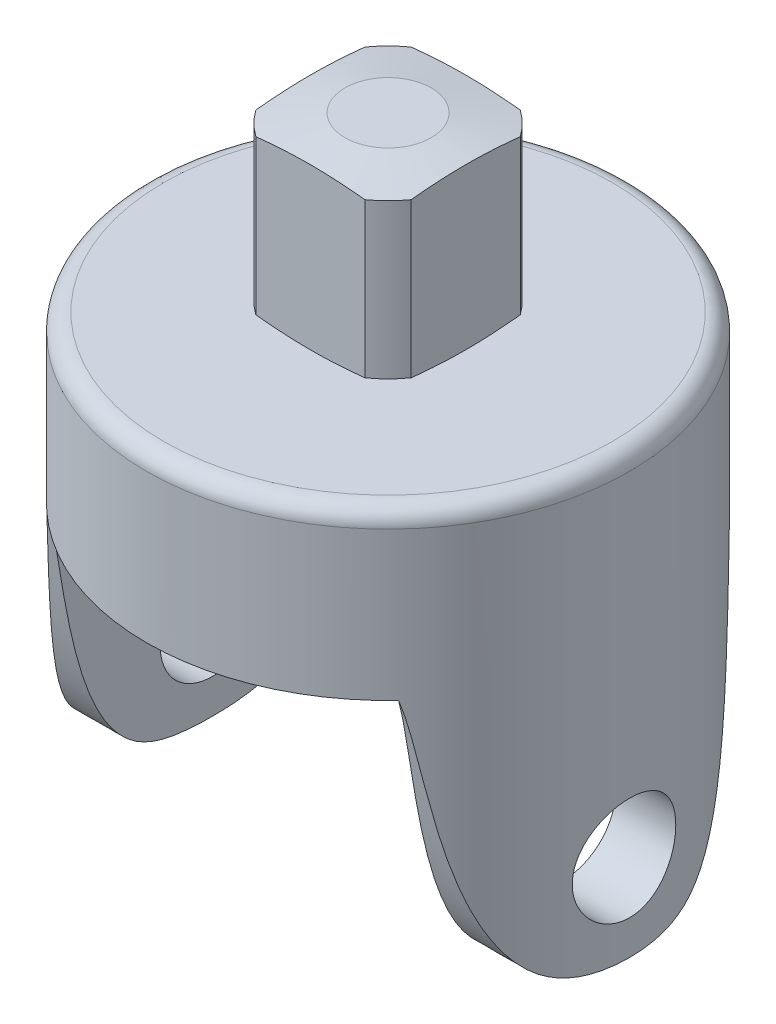
from build123d import *

# Parameters (mm, degrees)
BOSS_EXTRUDE1_DEPTH      = 102
BOSS_EXTRUDE1_DEPTH_BACK = 30
SKETCH1_R                = 70
SKETCH2_W                = 45
SKETCH2_H                = 45
BOSS_EXTRUDE2_DEPTH      = 50
FILLET1_R                = 5
FILLET2_R                = 5
SKETCH4_W                = 102
SKETCH4_H                = 150
CUT_EXTRUDE1_DEPTH       = 84
CUT_EXTRUDE3_DEPTH       = 72
CUT_EXTRUDE4_DEPTH       = 182.394597571
CUT_EXTRUDE4_DEPTH_BACK  = 182.394597571
SKETCH6_R                = 15


with BuildPart() as part:
    # Sketch1 → Boss-Extrude1 (new, two sides: drawn at the far end of the back side and taken through both)
    with BuildSketch(Plane(origin=(0, 0, 0), x_dir=(1, 0, 0), z_dir=(0, 1, 0)).offset(-BOSS_EXTRUDE1_DEPTH_BACK)):
        with Locations(Location((0, 0, 0), (0, 0, 270))):
            Circle(SKETCH1_R)
    extrude(amount=BOSS_EXTRUDE1_DEPTH + BOSS_EXTRUDE1_DEPTH_BACK)

    # Sketch2 → Boss-Extrude2 (add)
    with BuildSketch(Plane(origin=(0, 102, 0), x_dir=(1, 0, 0), z_dir=(0, 1, 0))):
        Rectangle(SKETCH2_W, SKETCH2_H)
    extrude(amount=BOSS_EXTRUDE2_DEPTH)

    # Fillet1
    fillet1_edges = [part.edges().sort_by_distance(p)[0] for p in [
        (0, 102, -70),
    ]]
    fillet(fillet1_edges, radius=FILLET1_R)

    # Fillet2
    fillet2_edges = [part.edges().sort_by_distance(p)[0] for p in [
        (0, -30, -70),
    ]]
    fillet(fillet2_edges, radius=FILLET2_R)

    # Sketch3 → Cut-Revolve2 (revolve, cut)
    with BuildSketch(Plane.XY, mode=Mode.PRIVATE) as cut_revolve2_sk:
        Polygon((-12.5, 152), (-47.512769581, 152), (-47.512769581, 102), (-12.5, 102), (-27.5, 104.644904711), (-27.5, 149.355095289), align=None)
    revolve(cut_revolve2_sk.sketch.rotate(Axis((0, 160.85, 0), (0, -1, 0)), 270), axis=Axis((0, 160.85, 0), (0, -1, 0)), mode=Mode.SUBTRACT)

    # Sketch4 → Cut-Extrude1 (cut)
    with BuildSketch(Plane.XZ.offset(30)):
        Rectangle(SKETCH4_W, SKETCH4_H)
    extrude(amount=-CUT_EXTRUDE1_DEPTH, mode=Mode.SUBTRACT)

    # Sketch5 → Cut-Extrude3 (cut, symmetric)
    with BuildSketch(Plane(origin=(0, 0, 0), x_dir=(0, 0, -1), z_dir=(1, 0, 0))):
        with BuildLine():
            Line((-47.947888379, 54), (-70, 54))
            Line((-70, 54), (-70, -34.210439424))
            Line((-70, -34.210439424), (78.024892387, -34.210439424))
            Line((78.024892387, -34.210439424), (78.024892387, 54))
            Line((78.024892387, 54), (47.947888379, 54))
            add(Edge.make_bspline(
                [(47.947888379, 54), (43.174062714, 36.113920215), (41.307491939, -20.223592095), (8.979551546, -25), (0, -25)],
                knots=[0, 0, 0, 0, 0.785107117, 1, 1, 1, 1], degree=3))
            add(Edge.make_bspline(
                [(-47.947888379, 54), (-43.174062714, 36.113920215), (-41.307491939, -20.223592095), (-8.979551546, -25), (0, -25)],
                knots=[0, 0, 0, 0, 0.785107117, 1, 1, 1, 1], degree=3))
        make_face()
    extrude(amount=CUT_EXTRUDE3_DEPTH, both=True, mode=Mode.SUBTRACT)

    # Sketch6 → Cut-Extrude4 (cut, two sides: drawn at the far end of the back side and taken through both)
    with BuildSketch(Plane(origin=(0, 0, 0), x_dir=(0, 0, -1), z_dir=(1, 0, 0)).offset(-CUT_EXTRUDE4_DEPTH_BACK)):
        Circle(SKETCH6_R)
    extrude(amount=CUT_EXTRUDE4_DEPTH + CUT_EXTRUDE4_DEPTH_BACK, mode=Mode.SUBTRACT)


solid = part.part
